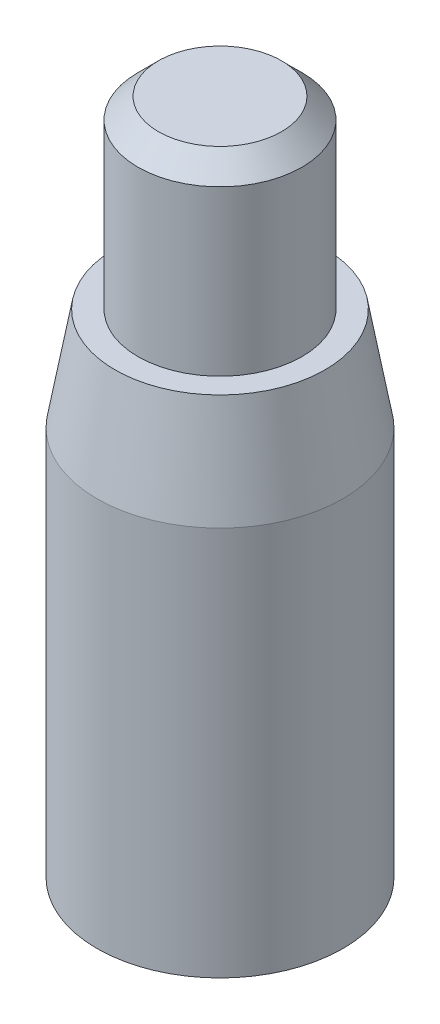
from build123d import *

# Parameters (mm, degrees)
CHANFREIN1_SIZE = 1


with BuildPart() as part:
    # Esquisse1 → Révolution1 (revolve)
    with BuildSketch(Plane.XY, mode=Mode.PRIVATE) as r_volution1_sk:
        Polygon((0, 0), (6, 0), (6, 19), (5.118365096, 24), (4, 24), (4, 33), (0, 33), align=None)
    revolve(r_volution1_sk.sketch.rotate(Axis((0, 0, 0), (0, 1, 0)), 90), axis=Axis((0, 0, 0), (0, 1, 0)))

    # Chanfrein1
    chanfrein1_edges = [part.edges().sort_by_distance(p)[0] for p in [
        (0, 33, 4),
    ]]
    chamfer(chanfrein1_edges, length=CHANFREIN1_SIZE)


solid = part.part
